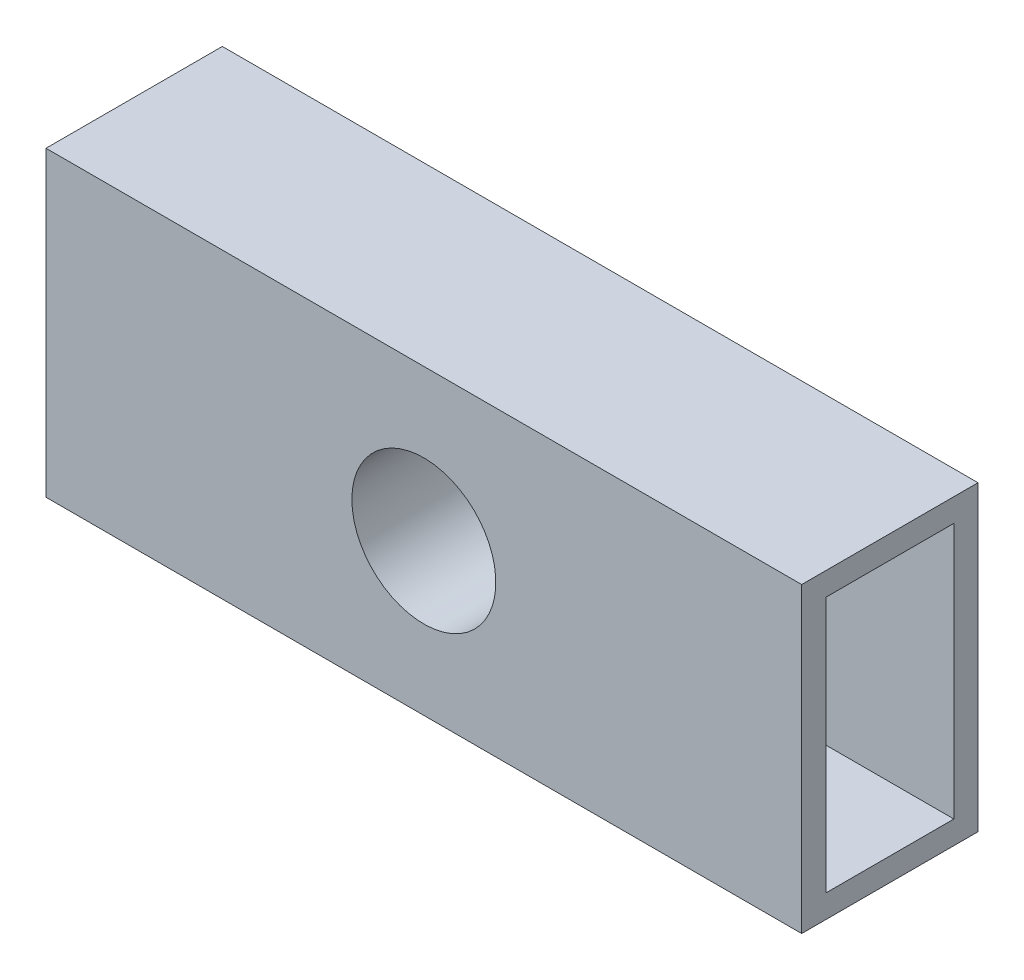
from build123d import *

# Parameters (mm, degrees)
SKETCH1_W                      = 150
SKETCH1_H                      = 60
BOSS_EXTRUDE1_DEPTH            = 17.5
SKETCH2_W                      = 25.43
SKETCH2_H                      = 50.83
CUT_EXTRUDE1_DEPTH             = 50.8
CUT_EXTRUDE2_REACH             = 84.651
SKETCH3_R                      = 14.2875
CUT_EXTRUDE2_DIRECTION_2_REACH = 84.651


with BuildPart() as part:
    # Sketch1 → Boss-Extrude1 (new, symmetric)
    with BuildSketch(Plane.XY):
        Rectangle(SKETCH1_W, SKETCH1_H)
    extrude(amount=BOSS_EXTRUDE1_DEPTH, both=True)

    # Sketch2 → Cut-Extrude1 (cut)
    with BuildSketch(Plane(origin=(75, 0, 0), x_dir=(0, 0, -1), z_dir=(1, 0, 0))):
        Rectangle(SKETCH2_W, SKETCH2_H)
    cut_extrude1 = extrude(amount=-CUT_EXTRUDE1_DEPTH, mode=Mode.SUBTRACT)

    # Cut-Extrude2: up to this face of the body (flat: up to its plane)
    cut_extrude2_end = Plane(part.part.faces().sort_by_distance((0, 0, 17.5))[0])
    # Sketch3 → Cut-Extrude2 (cut, up to the picked face)
    with BuildSketch(Plane.XY, mode=Mode.PRIVATE) as cut_extrude2_sk1:
        with Locations(Location((0, 0, 0), (0, 0, 180))):
            Circle(SKETCH3_R)
    cut_extrude2_tool1 = split(extrude(cut_extrude2_sk1.sketch, amount=CUT_EXTRUDE2_REACH, mode=Mode.PRIVATE), bisect_by=cut_extrude2_end, keep=Keep.BOTH, mode=Mode.PRIVATE)
    add(cut_extrude2_tool1.solids().sort_by(Axis((0, 0, 0), (0, 0, 1)))[0], mode=Mode.SUBTRACT)

    # Cut-Extrude2 direction 2: up to this face of the body (flat: up to its plane)
    cut_extrude2_direction_2_end = Plane(part.part.faces().sort_by_distance((0, 0, -17.5))[0])
    # Sketch3 → Cut-Extrude2 direction 2 (cut, up to the picked face)
    with BuildSketch(Plane.XY, mode=Mode.PRIVATE) as cut_extrude2_direction_2_sk1:
        with Locations(Location((0, 0, 0), (0, 0, 180))):
            Circle(SKETCH3_R)
    cut_extrude2_direction_2_tool1 = split(extrude(cut_extrude2_direction_2_sk1.sketch, amount=-CUT_EXTRUDE2_DIRECTION_2_REACH, mode=Mode.PRIVATE), bisect_by=cut_extrude2_direction_2_end, keep=Keep.BOTH, mode=Mode.PRIVATE)
    add(cut_extrude2_direction_2_tool1.solids().sort_by(Axis((0, 0, 0), (0, 0, -1)))[0], mode=Mode.SUBTRACT)

    # Mirror1: Cut-Extrude1 across plane
    add(cut_extrude1.mirror(Plane(origin=(0, 0, 0), x_dir=(0, 0, 1), z_dir=(1, 0, 0))), mode=Mode.SUBTRACT)


solid = part.part
